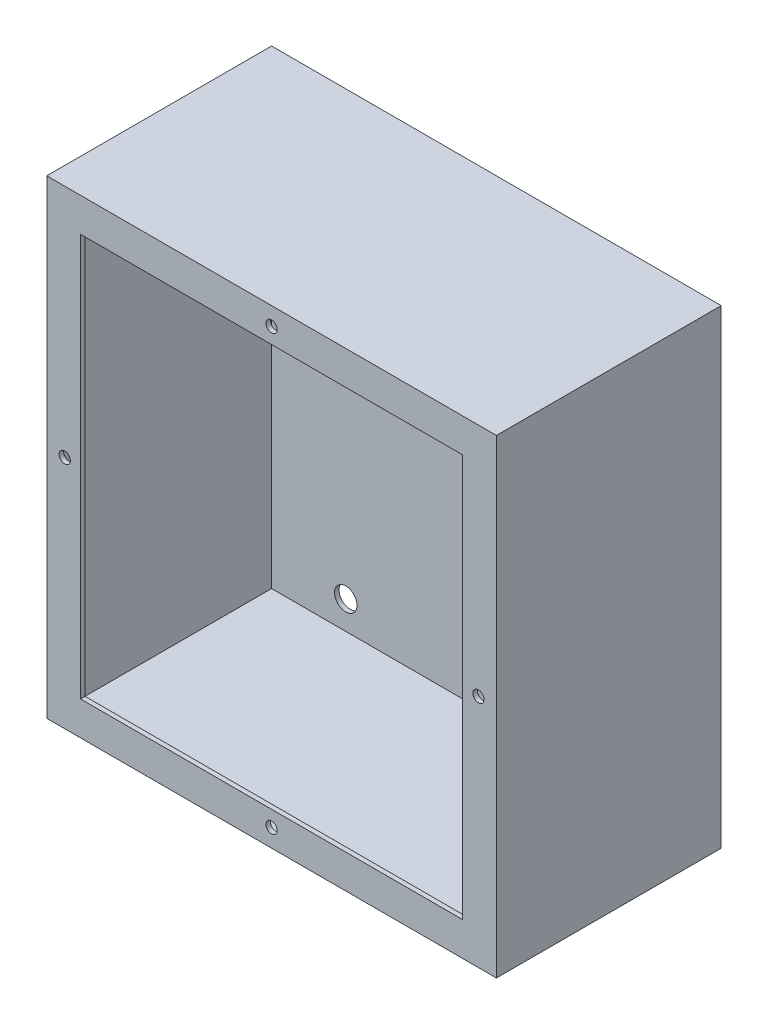
from build123d import *

# Parameters (mm, degrees)
SKETCH_1_W          = 200
SKETCH_1_H          = 209
EXTRUDE_1_DEPTH     = 100
SHELL_1_T           = -2
SKETCH_2_W          = 196
SKETCH_2_H          = 205
SKETCH_2_W_2        = 170
SKETCH_2_H_2        = 179
EXTRUDE_2_DEPTH     = 2
SKETCH_3_R          = 5
CUT_EXTRUDE_1_DEPTH = 22
SKETCH_4_R          = 2.5
CUT_EXTRUDE_2_DEPTH = 10


with BuildPart() as part:
    # 草图1 → 拉伸1 (new body)
    with BuildSketch(Plane.XY):
        with Locations((100, -104.5)):
            Rectangle(SKETCH_1_W, SKETCH_1_H)
    extrude(amount=EXTRUDE_1_DEPTH)

    # 抽壳1
    shell_1_openings = [part.faces().sort_by_distance(p)[0] for p in [
        (100, -104.5, 100),
    ]]
    offset(amount=SHELL_1_T, openings=shell_1_openings, kind=Kind.INTERSECTION)

    # 草图2 → 拉伸2 (add)
    with BuildSketch(Plane.XY.offset(100)):
        with Locations((100, -104.5)):
            Rectangle(SKETCH_2_W, SKETCH_2_H)
        with Locations((100, -104.5)):
            Rectangle(SKETCH_2_W_2, SKETCH_2_H_2, mode=Mode.SUBTRACT)
    extrude(amount=-EXTRUDE_2_DEPTH)

    # 草图3 → 切除-拉伸1 (cut)
    with BuildSketch(Plane(origin=(0, 0, 0), x_dir=(-1, 0, 0), z_dir=(0, 0, -1))):
        with Locations((-165, -14.5)):
            Circle(SKETCH_3_R)
        with Locations((-35, -14.5)):
            Circle(SKETCH_3_R)
        with Locations((-165, -194.5)):
            Circle(SKETCH_3_R)
        with Locations((-35, -194.5)):
            Circle(SKETCH_3_R)
    extrude(amount=-CUT_EXTRUDE_1_DEPTH, mode=Mode.SUBTRACT)

    # 草图4 → 切除-拉伸2 (cut)
    with BuildSketch(Plane.XY.offset(100)):
        with Locations((100, -8)):
            Circle(SKETCH_4_R)
        with Locations((192, -104.5)):
            Circle(SKETCH_4_R)
        with Locations((8, -104.5)):
            Circle(SKETCH_4_R)
        with Locations((100, -201)):
            Circle(SKETCH_4_R)
    extrude(amount=-CUT_EXTRUDE_2_DEPTH, mode=Mode.SUBTRACT)


solid = part.part
